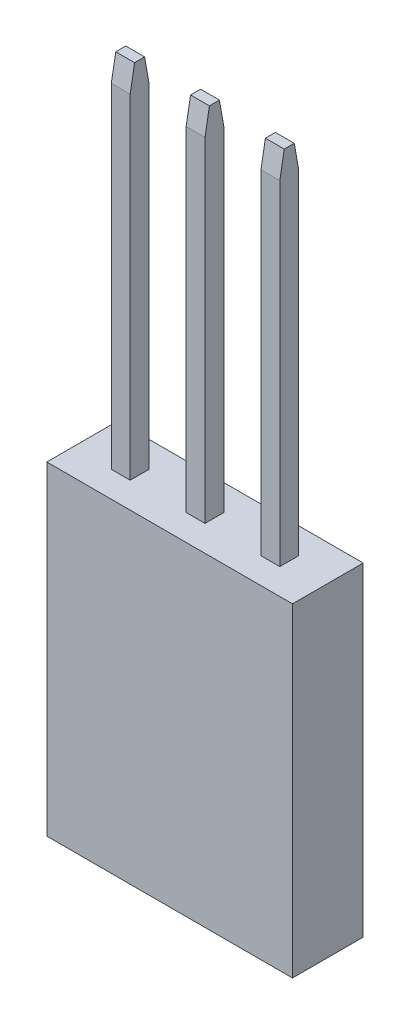
from build123d import *

# Parameters (mm, degrees)
SKETCH1_W             = 8.34
SKETCH1_H             = 2.4
BOSS_EXTRUDE1_DEPTH   = 11
SKETCH2_W             = 0.64
SKETCH2_H             = 0.64
BOSS_EXTRUDE2_DEPTH   = 12.2
BOSS_EXTRUDE2_2_DEPTH = 12.2
BOSS_EXTRUDE2_3_DEPTH = 12.2
CHAMFER1_SIZE         = 0.15
CHAMFER1_SIZE2        = 0.850692273
CHAMFER2_SIZE         = 0.15
CHAMFER2_SIZE2        = 0.850692273
CHAMFER3_SIZE         = 0.15
CHAMFER3_SIZE2        = 0.850692273
CUT_EXTRUDE1_START    = -11
SKETCH2_2_W           = 0.64
SKETCH2_2_H           = 0.64
CUT_EXTRUDE1_DEPTH    = 4
CHAMFER4_SIZE         = 0.3


with BuildPart() as part:
    # Sketch1 → Boss-Extrude1 (new body)
    with BuildSketch(Plane(origin=(0, 0, 0), x_dir=(1, 0, 0), z_dir=(0, 1, 0))):
        Rectangle(SKETCH1_W, SKETCH1_H)
    extrude(amount=-BOSS_EXTRUDE1_DEPTH)

    # Sketch2<2> → Cut-Extrude1 (cut)
    with BuildSketch(Plane(origin=(0, 0, 0), x_dir=(1, 0, 0), z_dir=(0, 1, 0)).offset(CUT_EXTRUDE1_START)):
        Rectangle(SKETCH2_2_W, SKETCH2_2_H)
        with Locations((-2.54, 0)):
            Rectangle(SKETCH2_2_W, SKETCH2_2_H)
        with Locations((2.54, 0)):
            Rectangle(SKETCH2_2_W, SKETCH2_2_H)
    extrude(amount=CUT_EXTRUDE1_DEPTH, mode=Mode.SUBTRACT)

    # Chamfer4
    chamfer4_edges = [part.edges().sort_by_distance(p)[0] for p in [
        (-0.32, -11, 0),
        (0, -11, 0.32),
        (0.32, -11, 0),
        (0, -11, -0.32),
        (-2.86, -11, 0),
        (-2.54, -11, 0.32),
        (-2.22, -11, 0),
        (-2.54, -11, -0.32),
        (2.54, -11, -0.32),
        (2.22, -11, 0),
        (2.54, -11, 0.32),
        (2.86, -11, 0),
    ]]
    chamfer(chamfer4_edges, length=CHAMFER4_SIZE)


with BuildPart() as body_2:
    # Sketch2 → Boss-Extrude2 (new body)
    with BuildSketch(Plane(origin=(0, 0, 0), x_dir=(1, 0, 0), z_dir=(0, 1, 0))):
        Rectangle(SKETCH2_W, SKETCH2_H)
    extrude(amount=BOSS_EXTRUDE2_DEPTH)

    # Chamfer2
    chamfer2_edges = [body_2.edges().sort_by_distance(p)[0] for p in [
        (0, 12.2, -0.32),
        (0, 12.2, 0.32),
    ]]
    chamfer2_side = [body_2.faces().sort_by_distance(p)[0] for p in [
        (0, 12.2, 0),
    ]]
    chamfer(chamfer2_edges, length=CHAMFER2_SIZE, length2=CHAMFER2_SIZE2, reference=chamfer2_side[0])


with BuildPart() as body_3:
    # Sketch2 → Boss-Extrude2 2 (new body)
    with BuildSketch(Plane(origin=(0, 0, 0), x_dir=(1, 0, 0), z_dir=(0, 1, 0))):
        with Locations((-2.54, 0)):
            Rectangle(SKETCH2_W, SKETCH2_H)
    extrude(amount=BOSS_EXTRUDE2_2_DEPTH)

    # Chamfer1
    chamfer1_edges = [body_3.edges().sort_by_distance(p)[0] for p in [
        (-2.54, 12.2, -0.32),
        (-2.54, 12.2, 0.32),
    ]]
    chamfer1_side = [body_3.faces().sort_by_distance(p)[0] for p in [
        (-2.54, 12.2, 0),
    ]]
    chamfer(chamfer1_edges, length=CHAMFER1_SIZE, length2=CHAMFER1_SIZE2, reference=chamfer1_side[0])


with BuildPart() as body_4:
    # Sketch2 → Boss-Extrude2 3 (new body)
    with BuildSketch(Plane(origin=(0, 0, 0), x_dir=(1, 0, 0), z_dir=(0, 1, 0))):
        with Locations((2.54, 0)):
            Rectangle(SKETCH2_W, SKETCH2_H)
    extrude(amount=BOSS_EXTRUDE2_3_DEPTH)

    # Chamfer3
    chamfer3_edges = [body_4.edges().sort_by_distance(p)[0] for p in [
        (2.54, 12.2, 0.32),
        (2.54, 12.2, -0.32),
    ]]
    chamfer3_side = [body_4.faces().sort_by_distance(p)[0] for p in [
        (2.54, 12.2, 0),
    ]]
    chamfer(chamfer3_edges, length=CHAMFER3_SIZE, length2=CHAMFER3_SIZE2, reference=chamfer3_side[0])


solid = Compound([part.part, body_2.part, body_3.part, body_4.part])
